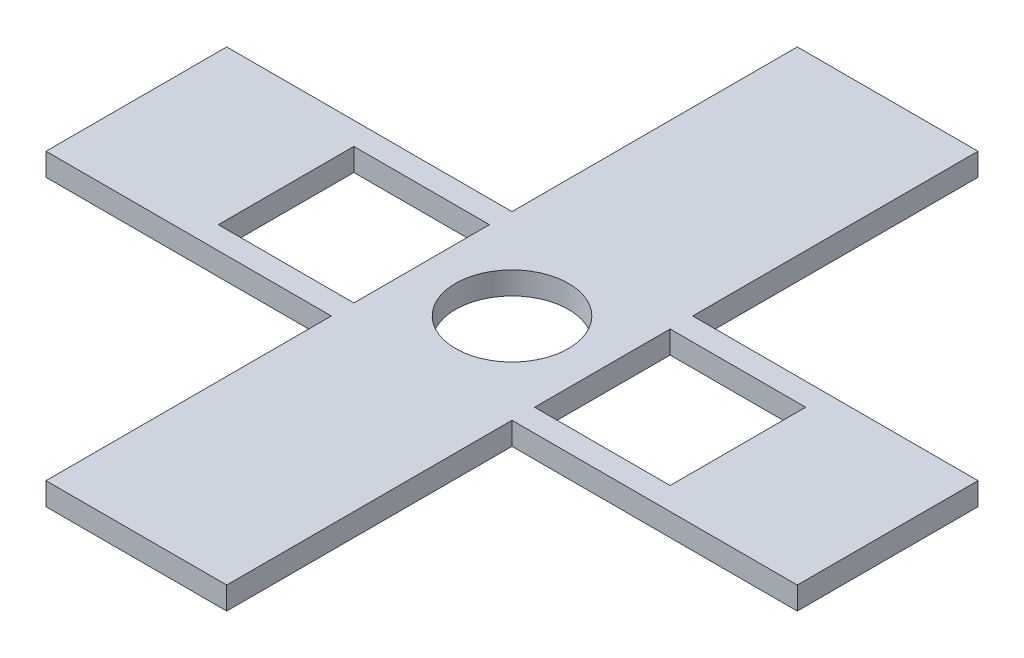
from build123d import *

# Parameters (mm, degrees)
SKETCH2_R           = 3.175
SKETCH2_W           = 7.62
SKETCH2_H           = 7.62
BOSS_EXTRUDE2_DEPTH = 1.27


with BuildPart() as part:
    # Sketch2 → Boss-Extrude2 (new body)
    with BuildSketch(Plane(origin=(0, 0, 0), x_dir=(1, 0, 0), z_dir=(0, 1, 0))):
        Polygon((-21.1201, -5.08), (-5.08, -5.08), (-5.08, -21.1201), (5.08, -21.1201), (5.08, -5.08), (21.1201, -5.08), (21.1201, 5.08), (5.08, 5.08), (5.08, 21.1201), (-5.08, 21.1201), (-5.08, 5.08), (-21.1201, 5.08), align=None)
        with Locations(Location((0, 0, 0), (0, 0, 270))):
            Circle(SKETCH2_R, mode=Mode.SUBTRACT)
        with Locations((8.89, 0)):
            Rectangle(SKETCH2_W, SKETCH2_H, mode=Mode.SUBTRACT)
        with Locations((-8.89, 0)):
            Rectangle(SKETCH2_W, SKETCH2_H, mode=Mode.SUBTRACT)
    extrude(amount=BOSS_EXTRUDE2_DEPTH)


solid = part.part
